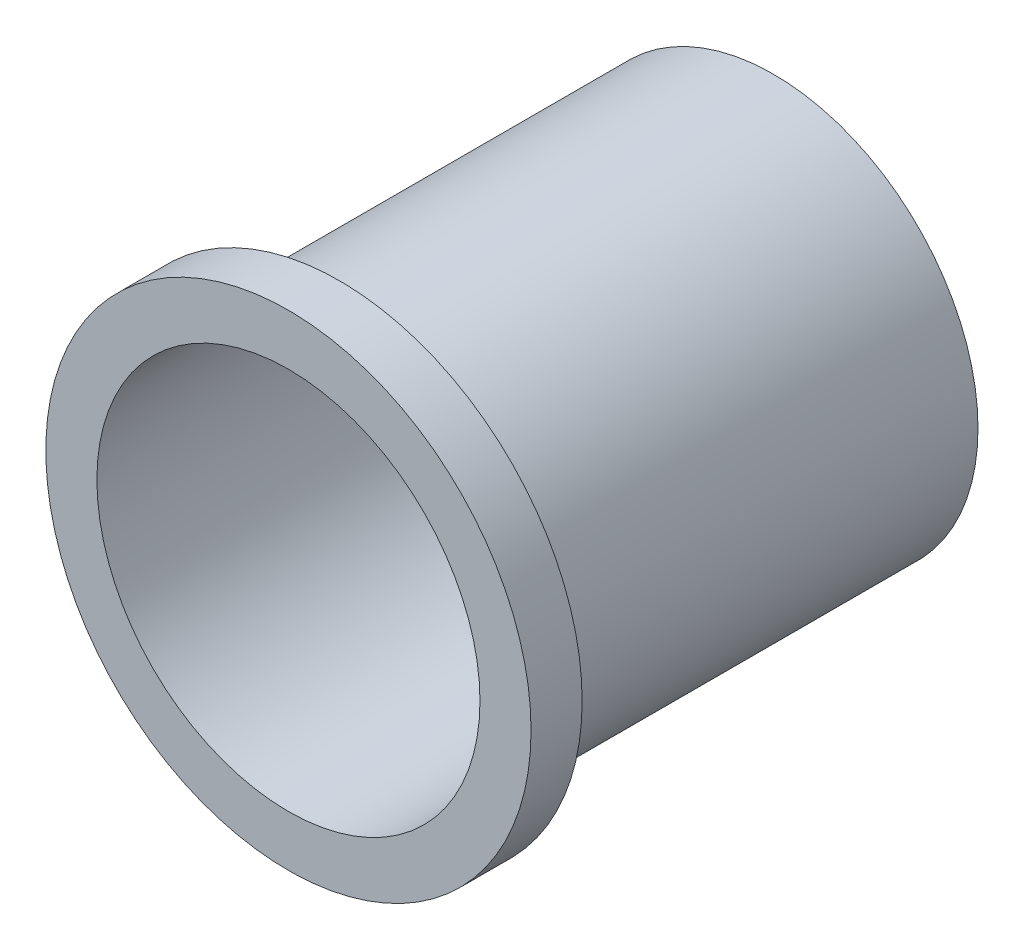
from build123d import *

# Parameters (mm, degrees)
SKETCH1_R           = 80
SKETCH1_R_2         = 15
BOSS_EXTRUDE1_DEPTH = 20
SKETCH2_R           = 80
SKETCH2_R_2         = 75
BOSS_EXTRUDE2_DEPTH = 150
SKETCH3_R           = 95
SKETCH3_R_2         = 75
BOSS_EXTRUDE3_DEPTH = 20
FILLET1_R           = 10


with BuildPart() as part:
    # Sketch1 → Boss-Extrude1 (new body)
    with BuildSketch(Plane.XY):
        Circle(SKETCH1_R)
        Circle(SKETCH1_R_2, mode=Mode.SUBTRACT)
    extrude(amount=BOSS_EXTRUDE1_DEPTH)

    # Sketch2 → Boss-Extrude2 (add)
    with BuildSketch(Plane.XY.offset(20)):
        Circle(SKETCH2_R)
        Circle(SKETCH2_R_2, mode=Mode.SUBTRACT)
    extrude(amount=BOSS_EXTRUDE2_DEPTH)

    # Sketch3 → Boss-Extrude3 (add)
    with BuildSketch(Plane.XY.offset(170)):
        Circle(SKETCH3_R)
        Circle(SKETCH3_R_2, mode=Mode.SUBTRACT)
    extrude(amount=BOSS_EXTRUDE3_DEPTH)

    # Fillet1
    fillet1_edges = [part.edges().sort_by_distance(p)[0] for p in [
        (-80, 0, 170),
    ]]
    fillet(fillet1_edges, radius=FILLET1_R)


solid = part.part
